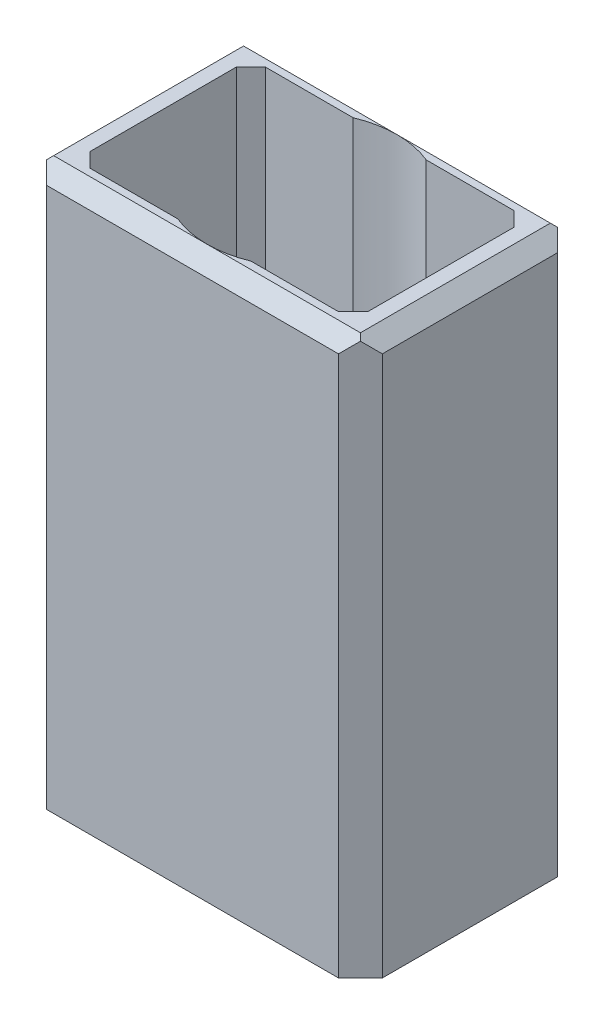
from build123d import *

# Parameters (mm, degrees)
SKETCH1_W           = 23
SKETCH1_H           = 15
SKETCH1_W_2         = 19
SKETCH1_H_2         = 12
BOSS_EXTRUDE1_DEPTH = 35
CHAMFER1_SIZE       = 1
CHAMFER2_SIZE       = 1
SKETCH2_W           = 23
SKETCH2_H           = 15
BOSS_EXTRUDE2_DEPTH = 3
CHAMFER4_SIZE       = 1.5
SKETCH3_R           = 2.5
CUT_EXTRUDE1_DEPTH  = 3
SKETCH5_R           = 6.5
CUT_EXTRUDE3_DEPTH  = 40


with BuildPart() as part:
    # Sketch1 → Boss-Extrude1 (new body)
    with BuildSketch(Plane(origin=(0, 0, 0), x_dir=(1, 0, 0), z_dir=(0, 1, 0))):
        Rectangle(SKETCH1_W, SKETCH1_H)
        Rectangle(SKETCH1_W_2, SKETCH1_H_2, mode=Mode.SUBTRACT)
    extrude(amount=BOSS_EXTRUDE1_DEPTH)

    # Chamfer1
    chamfer1_edges = [part.edges().sort_by_distance(p)[0] for p in [
        (-11.5, 35, 0),
        (0, 35, 7.5),
        (11.5, 35, 0),
        (0, 35, -7.5),
    ]]
    chamfer(chamfer1_edges, length=CHAMFER1_SIZE)

    # Chamfer2
    chamfer2_edges = [part.edges().sort_by_distance(p)[0] for p in [
        (9.5, 17.5, 6),
        (9.5, 17.5, -6),
        (-9.5, 17.5, -6),
        (-9.5, 17.5, 6),
    ]]
    chamfer(chamfer2_edges, length=CHAMFER2_SIZE)

    # Sketch2 → Boss-Extrude2 (add)
    with BuildSketch(Plane.XZ):
        Rectangle(SKETCH2_W, SKETCH2_H)
    extrude(amount=BOSS_EXTRUDE2_DEPTH)

    # Chamfer4
    chamfer4_edges = [part.edges().sort_by_distance(p)[0] for p in [
        (-11.5, 15.5, 7.5),
        (-11.5, 15.5, -7.5),
        (11.5, 15.5, -7.5),
        (11.5, 15.5, 7.5),
    ]]
    chamfer(chamfer4_edges, length=CHAMFER4_SIZE)

    # Sketch3 → Cut-Extrude1 (cut)
    with BuildSketch(Plane.XZ.offset(3)):
        with Locations(Location((0, 0, 0), (0, 0, 270))):
            Circle(SKETCH3_R)
    extrude(amount=-CUT_EXTRUDE1_DEPTH, mode=Mode.SUBTRACT)

    # Sketch5 → Cut-Extrude3 (cut)
    with BuildSketch(Plane(origin=(0, 0, 0), x_dir=(1, 0, 0), z_dir=(0, 1, 0))):
        Circle(SKETCH5_R)
    extrude(amount=CUT_EXTRUDE3_DEPTH, mode=Mode.SUBTRACT)


solid = part.part
